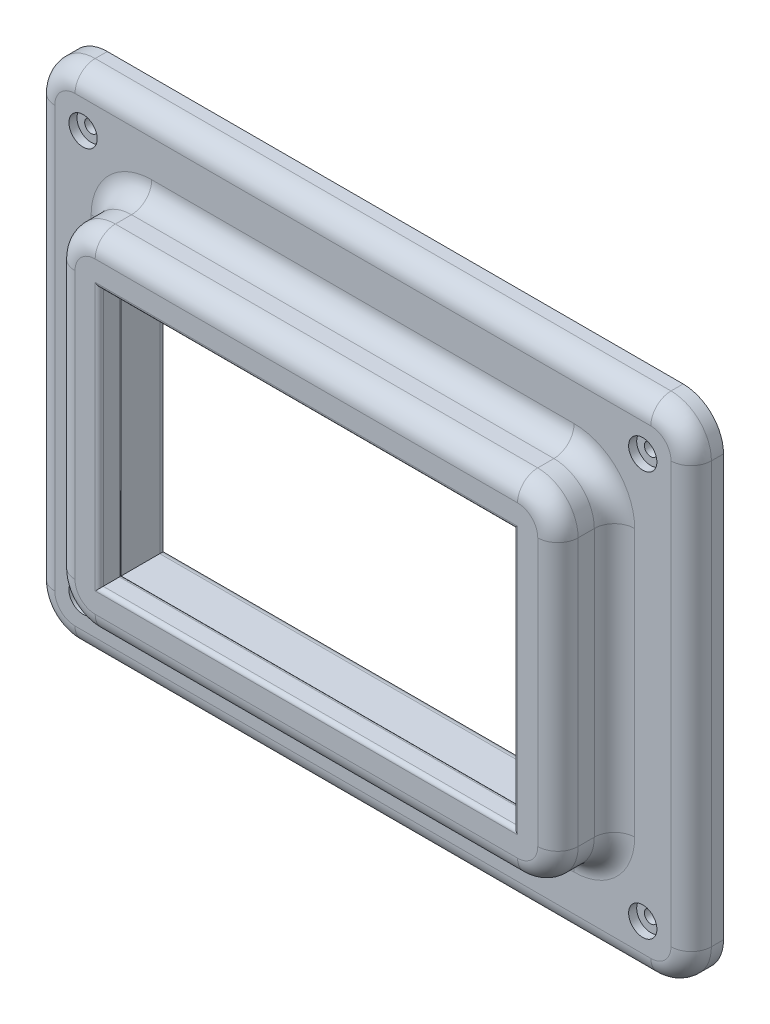
from build123d import *

# Parameters (mm, degrees)
SKETCH_1_W          = 162.6
SKETCH_1_H          = 124.2
SKETCH_1_R          = 1.6
SKETCH_1_W_2        = 102.6
SKETCH_1_H_2        = 64.2
EXTRUDE_1_DEPTH     = 22
SKETCH_2_R          = 3.5
CUT_EXTRUDE_1_DEPTH = 16
SKETCH_3_W          = 112.6
SKETCH_3_H          = 74.2
CUT_EXTRUDE_2_DEPTH = 16
SKETCH_4_W          = 162.6
SKETCH_4_H          = 124.2
SKETCH_4_W_2        = 124.6
SKETCH_4_H_2        = 86.2
CUT_EXTRUDE_3_DEPTH = 14
FILLET_1_R          = 10
FILLET_2_R          = 5
FILLET_3_R          = 1
FILLET_4_R          = 2
FILLET_5_R          = 1
FILLET_6_R          = 5


with BuildPart() as part:
    # 스케치1 → 보스-돌출1 (new body)
    with BuildSketch(Plane.XY):
        Rectangle(SKETCH_1_W, SKETCH_1_H)
        with Locations((-69.3, -50.1)):
            Circle(SKETCH_1_R, mode=Mode.SUBTRACT)
        with Locations((69.3, -50.1)):
            Circle(SKETCH_1_R, mode=Mode.SUBTRACT)
        with Locations((69.3, 50.1)):
            Circle(SKETCH_1_R, mode=Mode.SUBTRACT)
        with Locations((-69.3, 50.1)):
            Circle(SKETCH_1_R, mode=Mode.SUBTRACT)
        Rectangle(SKETCH_1_W_2, SKETCH_1_H_2, mode=Mode.SUBTRACT)
    extrude(amount=EXTRUDE_1_DEPTH)

    # 스케치2 → 컷-돌출1 (cut)
    with BuildSketch(Plane.XY.offset(22)):
        with Locations((-69.3, 50.1)):
            Circle(SKETCH_2_R)
        with Locations((69.3, 50.1)):
            Circle(SKETCH_2_R)
        with Locations((69.3, -50.1)):
            Circle(SKETCH_2_R)
        with Locations((-69.3, -50.1)):
            Circle(SKETCH_2_R)
    extrude(amount=-CUT_EXTRUDE_1_DEPTH, mode=Mode.SUBTRACT)

    # 스케치3 → 컷-돌출2 (cut)
    with BuildSketch(Plane(origin=(0, 0, 0), x_dir=(-1, 0, 0), z_dir=(0, 0, -1))):
        Rectangle(SKETCH_3_W, SKETCH_3_H)
    extrude(amount=-CUT_EXTRUDE_2_DEPTH, mode=Mode.SUBTRACT)

    # 스케치4 → 컷-돌출3 (cut)
    with BuildSketch(Plane.XY.offset(22)):
        Rectangle(SKETCH_4_W, SKETCH_4_H)
        Rectangle(SKETCH_4_W_2, SKETCH_4_H_2, mode=Mode.SUBTRACT)
    extrude(amount=-CUT_EXTRUDE_3_DEPTH, mode=Mode.SUBTRACT)

    # 필렛1
    fillet_1_edges = [part.edges().sort_by_distance(p)[0] for p in [
        (62.3, 43.1, 15),
        (-62.3, 43.1, 15),
        (-81.3, 62.1, 4),
        (81.3, 62.1, 4),
        (81.3, -62.1, 4),
        (-81.3, -62.1, 4),
        (-62.3, -43.1, 15),
        (62.3, -43.1, 15),
    ]]
    fillet(fillet_1_edges, radius=FILLET_1_R)

    # 필렛2
    fillet_2_edges = [part.edges().sort_by_distance(p)[0] for p in [
        (0, -43.1, 22),
        (-62.3, 0, 22),
        (62.3, 0, 22),
        (0, 43.1, 22),
        (-59.371067812, -40.171067812, 22),
        (-59.371067812, 40.171067812, 22),
        (59.371067812, 40.171067812, 22),
        (59.371067812, -40.171067812, 22),
        (0, 62.1, 8),
        (81.3, 0, 8),
        (-81.3, 0, 8),
        (0, -62.1, 8),
        (-78.371067812, 59.171067812, 8),
        (-78.371067812, -59.171067812, 8),
        (78.371067812, -59.171067812, 8),
        (78.371067812, 59.171067812, 8),
    ]]
    fillet(fillet_2_edges, radius=FILLET_2_R)

    # 필렛3
    fillet_3_edges = [part.edges().sort_by_distance(p)[0] for p in [
        (-51.3, 0, 22),
        (0, -32.1, 22),
        (51.3, 0, 22),
        (0, 32.1, 22),
    ]]
    fillet(fillet_3_edges, radius=FILLET_3_R)

    # 필렛4
    fillet_4_edges = [part.edges().sort_by_distance(p)[0] for p in [
        (-56.3, 0, 0),
        (0, 37.1, 0),
        (56.3, 0, 0),
        (0, -37.1, 0),
    ]]
    fillet(fillet_4_edges, radius=FILLET_4_R)

    # 필렛5
    fillet_5_edges = [part.edges().sort_by_distance(p)[0] for p in [
        (0, 32.1, 16),
        (-51.3, 0, 16),
        (0, -32.1, 16),
        (51.3, 0, 16),
    ]]
    fillet(fillet_5_edges, radius=FILLET_5_R)

    # 필렛6
    fillet_6_edges = [part.edges().sort_by_distance(p)[0] for p in [
        (0, -43.1, 8),
        (62.3, 0, 8),
        (0, 43.1, 8),
        (-62.3, 0, 8),
        (59.371067812, -40.171067812, 8),
        (59.371067812, 40.171067812, 8),
        (-59.371067812, 40.171067812, 8),
        (-59.371067812, -40.171067812, 8),
    ]]
    fillet(fillet_6_edges, radius=FILLET_6_R)


solid = part.part
